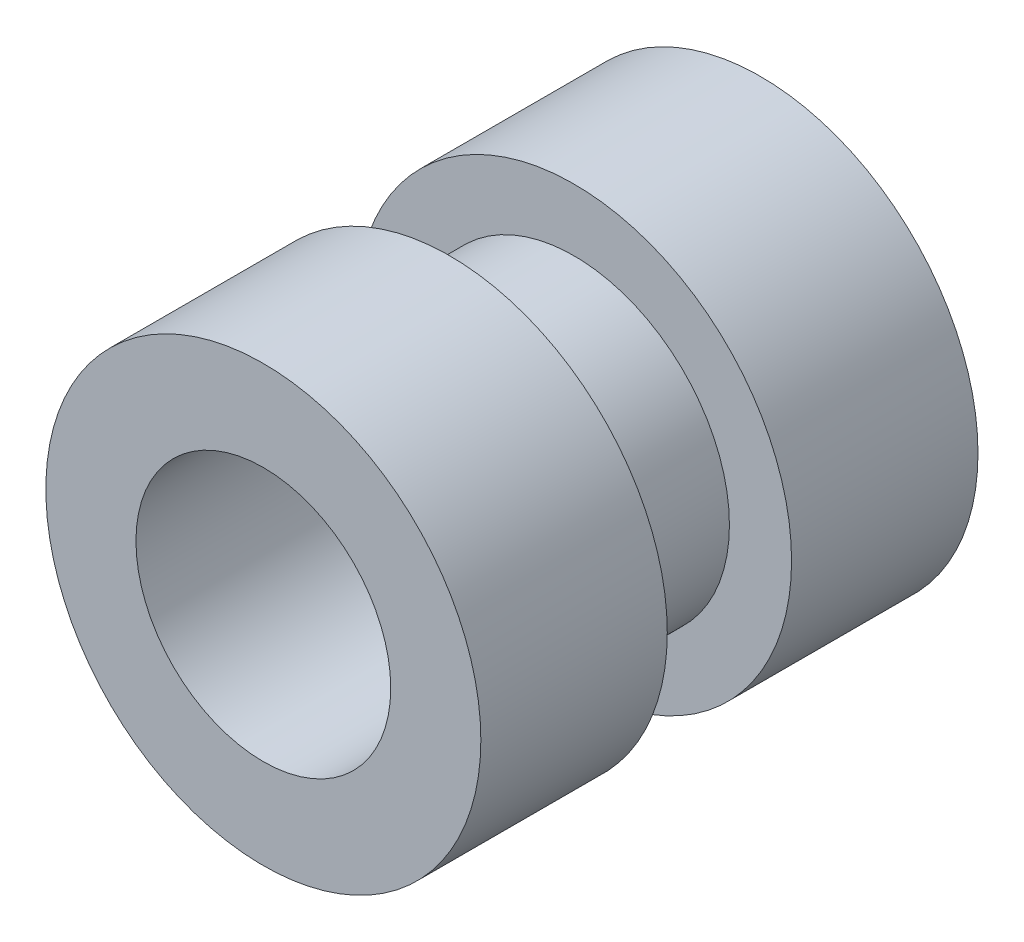
from build123d import *

# Parameters (mm, degrees)
SKETCH_1_R           = 1.75
EXTRUDE_1_DEPTH      = 1.5
SKETCH_2_R           = 1.25
EXTRUDE_2_DEPTH      = 1
SKETCH_3_R           = 1.75
EXTRUDE_3_DEPTH      = 1.5
HOLE_WIZARD_M2_5_1_D = 2.05


with BuildPart() as part:
    # 草图1 → 凸台-拉伸1 (new body)
    with BuildSketch(Plane.XY):
        Circle(SKETCH_1_R)
    extrude(amount=EXTRUDE_1_DEPTH)

    # 草图2 → 凸台-拉伸2 (add)
    with BuildSketch(Plane.XY.offset(1.5)):
        Circle(SKETCH_2_R)
    extrude(amount=EXTRUDE_2_DEPTH)

    # 草图3 → 凸台-拉伸3 (add)
    with BuildSketch(Plane.XY.offset(2.5)):
        Circle(SKETCH_3_R)
    extrude(amount=EXTRUDE_3_DEPTH)

    # M2.5 螺纹孔1 (through all)
    with Locations(Plane.XY.offset(4)):
        with Locations((0, 0)):
            Hole(HOLE_WIZARD_M2_5_1_D / 2)


solid = part.part
